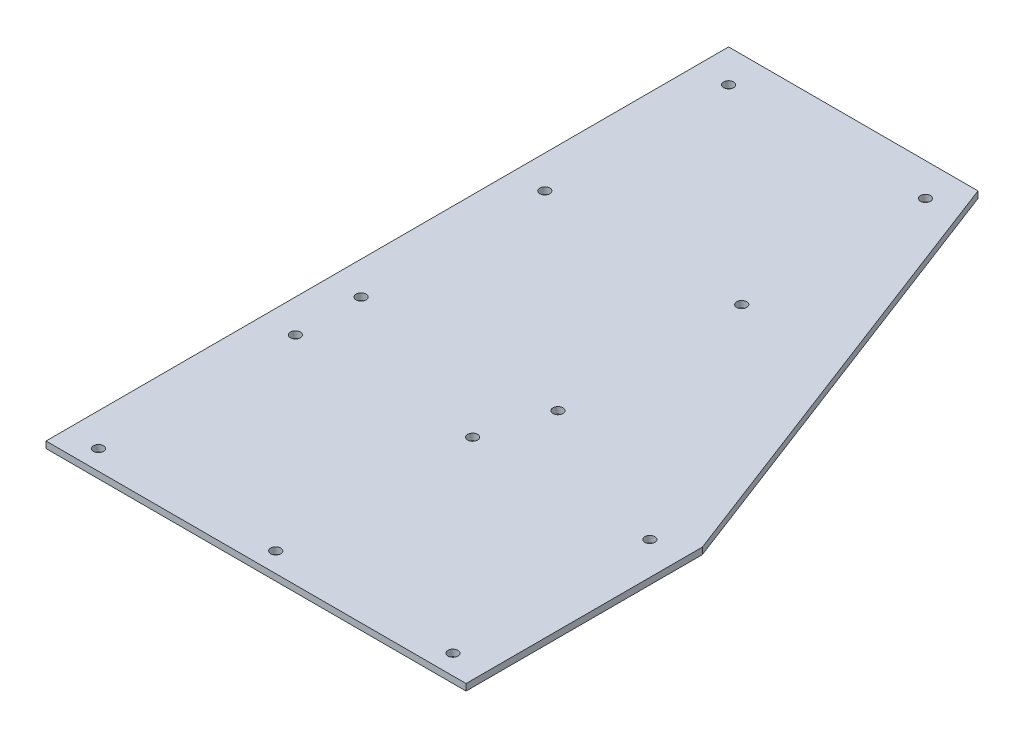
from build123d import *

# Parameters (mm, degrees)
SKETCH1_R           = 2.4257
BOSS_EXTRUDE1_DEPTH = 3.175


with BuildPart() as part:
    # Sketch1 → Boss-Extrude1 (new body)
    with BuildSketch(Plane(origin=(0, 0, 0), x_dir=(1, 0, 0), z_dir=(0, 1, 0))):
        Polygon((0, 0), (203.2, 0), (203.2, 114.3), (120.65, 330.2), (0, 330.2), align=None)
        with Locations(Location((15.875, 9.525, 0), (0, 0, 270))):
            Circle(SKETCH1_R, mode=Mode.SUBTRACT)
        with Locations(Location((101.6, 9.525, 0), (0, 0, 270))):
            Circle(SKETCH1_R, mode=Mode.SUBTRACT)
        with Locations(Location((187.325, 9.525, 0), (0, 0, 270))):
            Circle(SKETCH1_R, mode=Mode.SUBTRACT)
        with Locations(Location((15.875, 104.775, 0), (0, 0, 270))):
            Circle(SKETCH1_R, mode=Mode.SUBTRACT)
        with Locations(Location((187.325, 104.775, 0), (0, 0, 270))):
            Circle(SKETCH1_R, mode=Mode.SUBTRACT)
        with Locations(Location((101.6, 104.775, 0), (0, 0, 270))):
            Circle(SKETCH1_R, mode=Mode.SUBTRACT)
        with Locations(Location((15.875, 136.525, 0), (0, 0, 270))):
            Circle(SKETCH1_R, mode=Mode.SUBTRACT)
        with Locations(Location((111.125, 136.525, 0), (0, 0, 270))):
            Circle(SKETCH1_R, mode=Mode.SUBTRACT)
        with Locations(Location((15.875, 225.425, 0), (0, 0, 270))):
            Circle(SKETCH1_R, mode=Mode.SUBTRACT)
        with Locations(Location((15.875, 314.325, 0), (0, 0, 270))):
            Circle(SKETCH1_R, mode=Mode.SUBTRACT)
        with Locations(Location((111.125, 225.425, 0), (0, 0, 270))):
            Circle(SKETCH1_R, mode=Mode.SUBTRACT)
        with Locations(Location((111.125, 314.325, 0), (0, 0, 270))):
            Circle(SKETCH1_R, mode=Mode.SUBTRACT)
    extrude(amount=BOSS_EXTRUDE1_DEPTH)


solid = part.part
